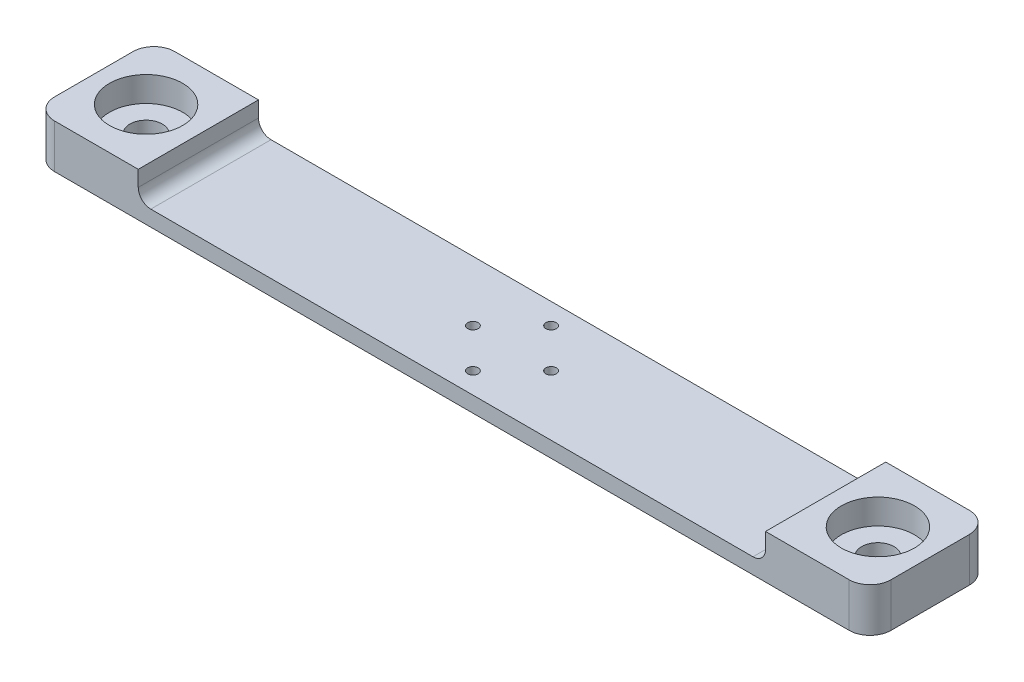
from build123d import *

# Parameters (mm, degrees)
SKETCH1_R                = 13.97
SKETCH1_R_2              = 1.275
BOSS_EXTRUDE1_DEPTH      = 3.048
BOSS_EXTRUDE2_DEPTH      = 7.62
BOSS_EXTRUDE2_DEPTH_BACK = 3.048
SKETCH2_R                = 8.89
SKETCH2_R_2              = 1.275
CUT_EXTRUDE2_DEPTH       = 107.252483849
SKETCH6_R                = 8.89
SKETCH6_R_2              = 3.937
BOSS_EXTRUDE3_DEPTH      = 4.572
FILLET2_R                = 3.048


with BuildPart() as part:
    # Sketch1 → Boss-Extrude1 (new body)
    with BuildSketch(Plane(origin=(0, 0, 0), x_dir=(1, 0, 0), z_dir=(0, 1, 0))):
        with Locations(Location((0, 0, 0), (0, 0, 90))):
            Circle(SKETCH1_R)
        with Locations(Location((0, 9.5, 0), (0, 0, 90))):
            Circle(SKETCH1_R_2, mode=Mode.SUBTRACT)
        with Locations(Location((9.5, 0, 0), (0, 0, 90))):
            Circle(SKETCH1_R_2, mode=Mode.SUBTRACT)
        with Locations(Location((0, -9.5, 0), (0, 0, 90))):
            Circle(SKETCH1_R_2, mode=Mode.SUBTRACT)
        with Locations(Location((-9.5, 0, 0), (0, 0, 90))):
            Circle(SKETCH1_R_2, mode=Mode.SUBTRACT)
    extrude(amount=BOSS_EXTRUDE1_DEPTH)

    # Sketch2 → Boss-Extrude2 (add, two sides: drawn at the far end of the back side and taken through both)
    with BuildSketch(Plane(origin=(0, 3.048, 0), x_dir=(1, 0, 0), z_dir=(0, 1, 0)).offset(-BOSS_EXTRUDE2_DEPTH_BACK)):
        with BuildLine():
            Line((-96.52, -14.605), (96.52, -14.605))
            ThreePointArc((96.52, -14.605), (100.112102448, -13.117102448), (101.6, -9.525))
            Line((101.6, -9.525), (101.6, 9.525))
            ThreePointArc((101.6, 9.525), (100.112102448, 13.117102448), (96.52, 14.605))
            Line((96.52, 14.605), (-96.52, 14.605))
            ThreePointArc((-96.52, 14.605), (-100.112102448, 13.117102448), (-101.6, 9.525))
            Line((-101.6, 9.525), (-101.6, -9.525))
            ThreePointArc((-101.6, -9.525), (-100.112102448, -13.117102448), (-96.52, -14.605))
        make_face()
        with Locations(Location((-88.9, 0, 0), (0, 0, 270))):
            Circle(SKETCH2_R, mode=Mode.SUBTRACT)
        with Locations(Location((88.9, 0, 0), (0, 0, 270))):
            Circle(SKETCH2_R, mode=Mode.SUBTRACT)
        with Locations(Location((9.5, 0, 0), (0, 0, 90))):
            Circle(SKETCH2_R_2, mode=Mode.SUBTRACT)
        with Locations(Location((0, 9.5, 0), (0, 0, 90))):
            Circle(SKETCH2_R_2, mode=Mode.SUBTRACT)
        with Locations(Location((-9.5, 0, 0), (0, 0, 90))):
            Circle(SKETCH2_R_2, mode=Mode.SUBTRACT)
        with Locations(Location((0, -9.5, 0), (0, 0, 90))):
            Circle(SKETCH2_R_2, mode=Mode.SUBTRACT)
    extrude(amount=BOSS_EXTRUDE2_DEPTH + BOSS_EXTRUDE2_DEPTH_BACK)

    # Sketch5 → Cut-Extrude2 (cut, through all)
    with BuildSketch(Plane(origin=(0, 0, -14.605), x_dir=(-1, 0, 0), z_dir=(0, 0, -1))):
        Polygon((-76.2, 3.81), (0, 3.81), (76.2, 3.81), (76.2, 10.668), (-76.2, 10.668), align=None)
    extrude(amount=-CUT_EXTRUDE2_DEPTH, mode=Mode.SUBTRACT)

    # Sketch6 → Boss-Extrude3 (add)
    # profile 1 of 2: a face of its own
    with BuildSketch(Plane.XZ):
        with Locations(Location((-88.9, 0, 0), (0, 0, 90))):
            Circle(SKETCH6_R)
        with Locations(Location((-88.9, 0, 0), (0, 0, 270))):
            Circle(SKETCH6_R_2, mode=Mode.SUBTRACT)
    # profile 2 of 2: a face of its own
    with BuildSketch(Plane.XZ):
        with Locations(Location((88.9, 0, 0), (0, 0, 90))):
            Circle(SKETCH6_R)
        with Locations(Location((88.9, 0, 0), (0, 0, 270))):
            Circle(SKETCH6_R_2, mode=Mode.SUBTRACT)
    extrude(amount=-BOSS_EXTRUDE3_DEPTH)

    # Fillet2
    fillet2_edges = [part.edges().sort_by_distance(p)[0] for p in [
        (-76.2, 3.81, 0),
        (76.2, 3.81, 0),
    ]]
    fillet(fillet2_edges, radius=FILLET2_R)


solid = part.part
